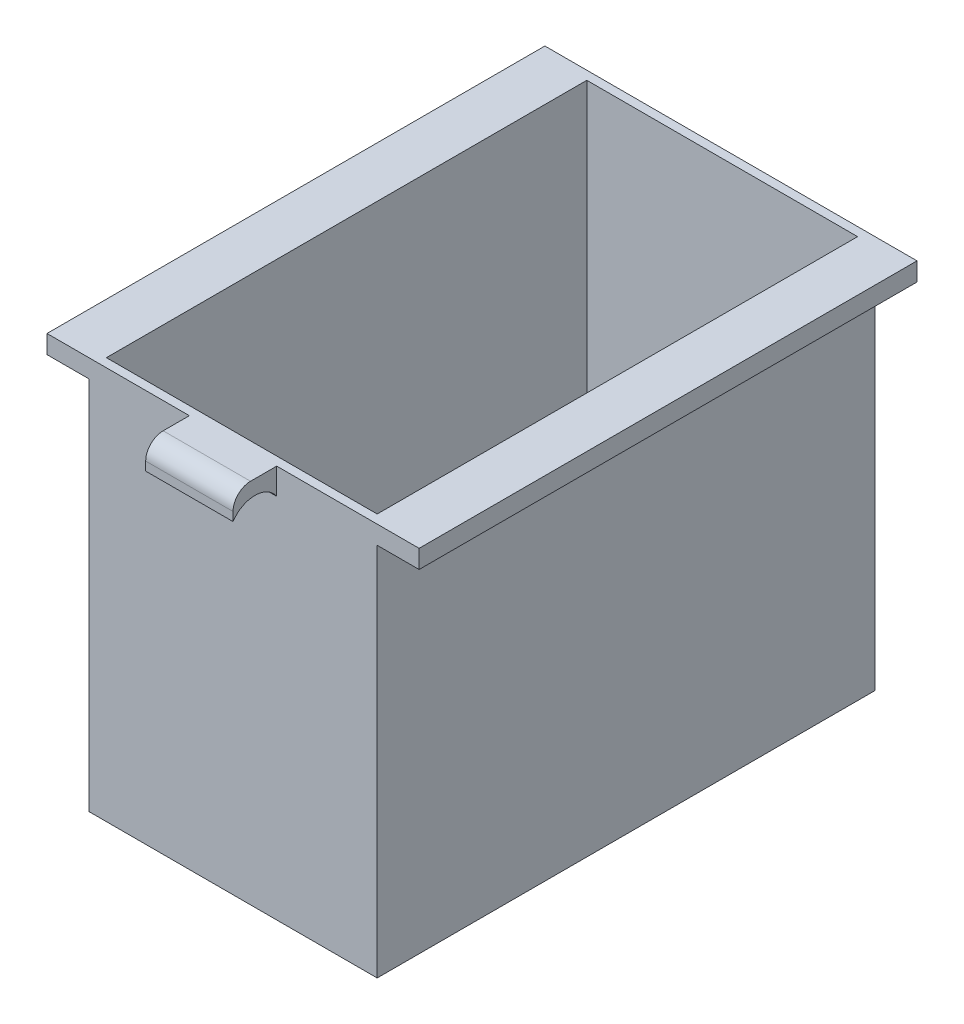
from build123d import *

# Parameters (mm, degrees)
SKETCH1_W           = 33
SKETCH1_H           = 57
BOSS_EXTRUDE1_DEPTH = 45
SHELL1_T            = -1
SKETCH3_W           = 57
SKETCH3_H           = 2.1
BOSS_EXTRUDE2_DEPTH = 4.8
SKETCH4_W           = 10
SKETCH4_H           = 3
BOSS_EXTRUDE3_DEPTH = 5
CUT_EXTRUDE1_DEPTH  = 10
FILLET2_R           = 2


with BuildPart() as part:
    # Sketch1 → Boss-Extrude1 (new body)
    with BuildSketch(Plane(origin=(0, 0, 0), x_dir=(1, 0, 0), z_dir=(0, 1, 0))):
        Rectangle(SKETCH1_W, SKETCH1_H)
    extrude(amount=BOSS_EXTRUDE1_DEPTH)

    # Shell1
    shell1_openings = [part.faces().sort_by_distance(p)[0] for p in [
        (0, 45, 0),
    ]]
    offset(amount=SHELL1_T, openings=shell1_openings, kind=Kind.INTERSECTION)

    # Sketch3 → Boss-Extrude2 (add)
    with BuildSketch(Plane.ZY.offset(16.5)):
        with Locations((0, 43.95)):
            Rectangle(SKETCH3_W, SKETCH3_H)
    boss_extrude2 = extrude(amount=BOSS_EXTRUDE2_DEPTH)

    # Mirror1: Boss-Extrude2 across plane
    add(boss_extrude2.mirror(Plane(origin=(0, 0, 0), x_dir=(0, 0, 1), z_dir=(1, 0, 0))))

    # Sketch4 → Boss-Extrude3 (add)
    with BuildSketch(Plane.XY.offset(28.5)):
        with Locations((0, 43.5)):
            Rectangle(SKETCH4_W, SKETCH4_H)
    extrude(amount=BOSS_EXTRUDE3_DEPTH)

    # Sketch5 → Cut-Extrude1 (cut)
    with BuildSketch(Plane.ZY.offset(5)):
        with BuildLine():
            Line((28.5, 42), (33.5, 42))
            ThreePointArc((33.5, 42), (31, 43.341687605), (28.5, 42))
        make_face()
    extrude(amount=-CUT_EXTRUDE1_DEPTH, mode=Mode.SUBTRACT)

    # Fillet2
    fillet2_edges = [part.edges().sort_by_distance(p)[0] for p in [
        (0, 45, 33.5),
    ]]
    fillet(fillet2_edges, radius=FILLET2_R)


solid = part.part
